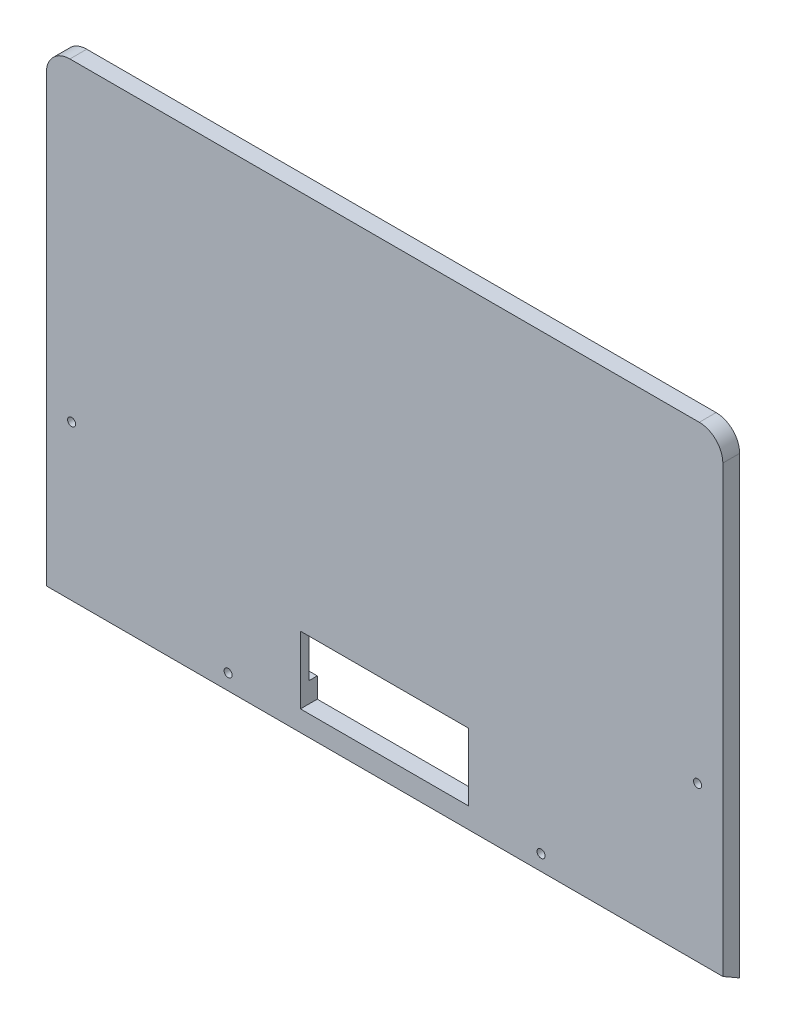
from build123d import *

# Parameters (mm, degrees)
SKETCH_3_W                = 201
SKETCH_3_H                = 142
EXTRUDE_2_DEPTH           = 5
SKETCH_4_W                = 171
SKETCH_4_H                = 112
CUT_EXTRUDE_1_DEPTH       = 2.5
SKETCH_5_W                = 50
SKETCH_5_H                = 20
CUT_EXTRUDE_6_DEPTH       = 15
SKETCH_6_R                = 1.2
CUT_EXTRUDE_7_DEPTH       = 3
CUT_EXTRUDE_8_REACH       = 215.23
HOLE_WIZARD_1_D           = 2.4
HOLE_WIZARD_1_CSINK_D     = 4.5
HOLE_WIZARD_1_CSINK_ANGLE = 90
FILLET_1_R                = 7


with BuildPart() as part:
    # 草图3 → 凸台-拉伸2 (new body)
    with BuildSketch(Plane.XY):
        Rectangle(SKETCH_3_W, SKETCH_3_H)
    extrude(amount=EXTRUDE_2_DEPTH)

    # 草图4 → 切除-拉伸1 (cut)
    with BuildSketch(Plane.XY):
        Rectangle(SKETCH_4_W, SKETCH_4_H)
    extrude(amount=CUT_EXTRUDE_1_DEPTH, mode=Mode.SUBTRACT)

    # 草图5 → 切除-拉伸6 (cut)
    with BuildSketch(Plane.XY):
        with Locations((0, -52)):
            Rectangle(SKETCH_5_W, SKETCH_5_H)
    extrude(amount=CUT_EXTRUDE_6_DEPTH, mode=Mode.SUBTRACT)

    # 草图6 → 切除-拉伸7 (cut)
    with BuildSketch(Plane(origin=(0, 0, 0), x_dir=(-1, 0, 0), z_dir=(0, 0, -1))):
        with Locations((-93, 63.5)):
            Circle(SKETCH_6_R)
        with Locations((93, 63.5)):
            Circle(SKETCH_6_R)
        with Locations((93, -63.5)):
            Circle(SKETCH_6_R)
        with Locations((-93, -63.5)):
            Circle(SKETCH_6_R)
    extrude(amount=-CUT_EXTRUDE_7_DEPTH, mode=Mode.SUBTRACT)

    # 草图9 → 切除-拉伸8 (cut, up to next)
    with BuildSketch(Plane.ZY.offset(100.5), mode=Mode.PRIVATE) as cut_extrude_8_sk1:
        Polygon((0, -71), (5, -71), (5, -68.113248654), align=None)
    cut_extrude_8_tool1 = extrude(cut_extrude_8_sk1.sketch, amount=-CUT_EXTRUDE_8_REACH, mode=Mode.PRIVATE) & part.part
    add(cut_extrude_8_tool1.solids().sort_by_distance((-100.5, -70.03775, 3.333333))[0], mode=Mode.SUBTRACT)

    # 打孔尺寸(%根据十字)槽沉头自攻螺钉的类型1 (through all)
    with Locations(Plane(origin=(0, 0, 0), x_dir=(-1, 0, 0), z_dir=(0, 0, -1))):
        with Locations((-93, -22.170448124), (-46.5, -63.5), (46.5, -63.5), (93, -22.170448124)):
            CounterSinkHole(HOLE_WIZARD_1_D / 2, HOLE_WIZARD_1_CSINK_D / 2, counter_sink_angle=HOLE_WIZARD_1_CSINK_ANGLE)

    # 圆角1
    fillet_1_edges = [part.edges().sort_by_distance(p)[0] for p in [
        (-100.5, 71, 2.5),
        (100.5, 71, 2.5),
    ]]
    fillet(fillet_1_edges, radius=FILLET_1_R)


solid = part.part
